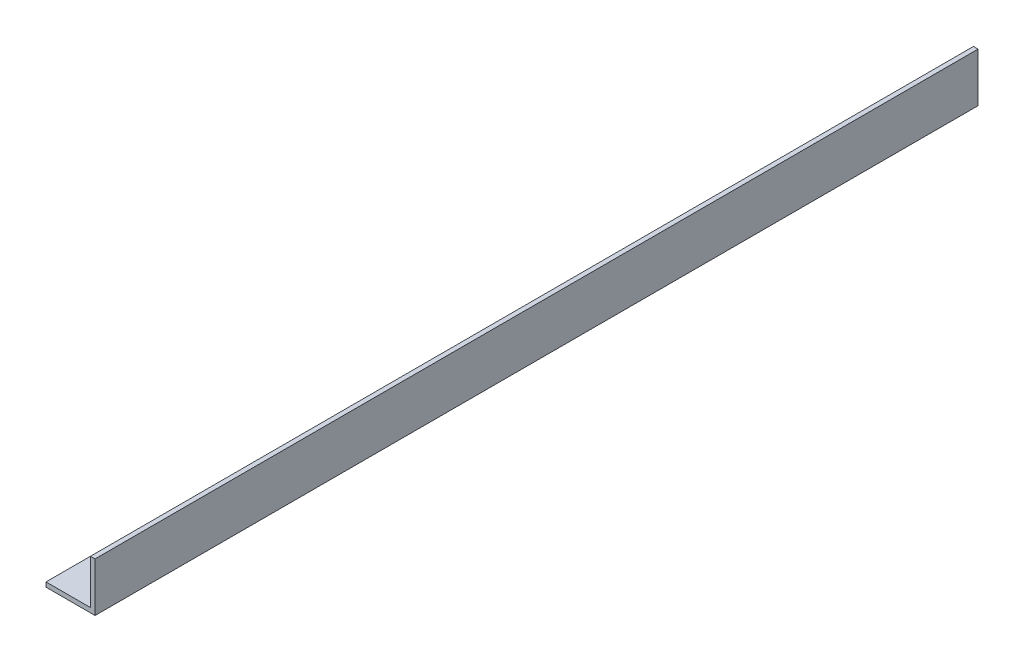
from build123d import *

# Parameters (mm, degrees)
BOSS_EXTRUDE1_DEPTH      = 114.3
BOSS_EXTRUDE1_DEPTH_BACK = 114.3


with BuildPart() as part:
    # Sketch3 → Boss-Extrude1 (new, two sides: drawn at the far end of the back side and taken through both)
    with BuildSketch(Plane.XY.offset(-BOSS_EXTRUDE1_DEPTH_BACK)):
        Polygon((-12.7, 0), (0, 0), (0, 12.7), (-1.190625, 12.7), (-1.190625, 1.190625), (-12.7, 1.190625), align=None)
    extrude(amount=BOSS_EXTRUDE1_DEPTH + BOSS_EXTRUDE1_DEPTH_BACK)


solid = part.part
